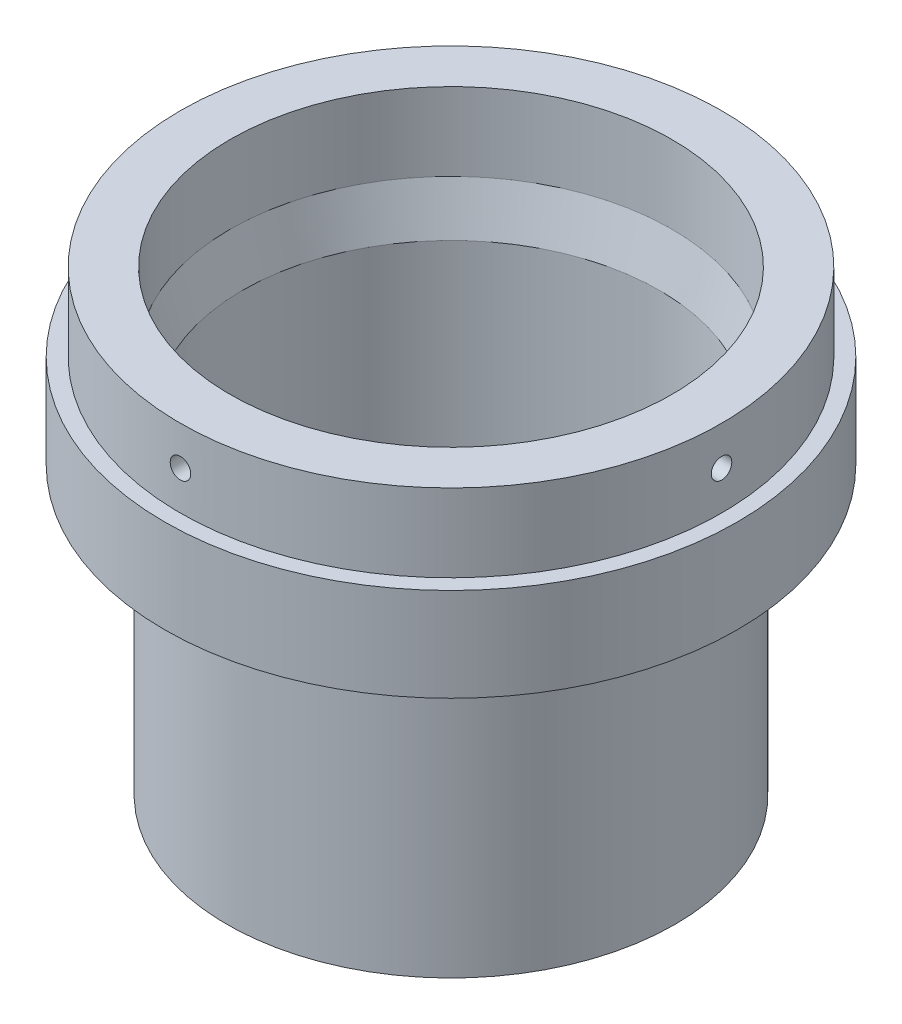
from build123d import *

# Parameters (mm, degrees)
CIRPATTERN1_COUNT = 4


with BuildPart() as part:
    # Sketch1 → Revolve1 (revolve)
    with BuildSketch(Plane.XY):
        Polygon((-71, 0), (-71, 25), (-87, 25), (-87, 0), (-92, 0), (-92, -30), (-72, -30), (-72, -122), (-67, -122), (-67, -15), align=None)
    revolve(axis=Axis((0, 25, 0), (0, -1, 0)))

    # Sketch6 → M6 Clearance Hole2 (revolve, cut)
    with BuildSketch(Plane(origin=(-87, 12.5, 0), x_dir=(0, 0, 1), z_dir=(0, 1, 0))):
        Polygon((0, 0), (0, 14), (3.3, 12.017159957), (3.3, 0), align=None)
    m6_clearance_hole2 = revolve(axis=Axis((-93.35, 12.5, 0), (1, 0, 0)), mode=Mode.SUBTRACT)

    # CirPattern1: M6 Clearance Hole2 ×4 about axis
    cirpattern1_axis = Axis((0, 25, 0), (0, 1, 0))
    for i in range(1, CIRPATTERN1_COUNT):
        add(m6_clearance_hole2.rotate(cirpattern1_axis, i * 360 / CIRPATTERN1_COUNT), mode=Mode.SUBTRACT)


solid = part.part
